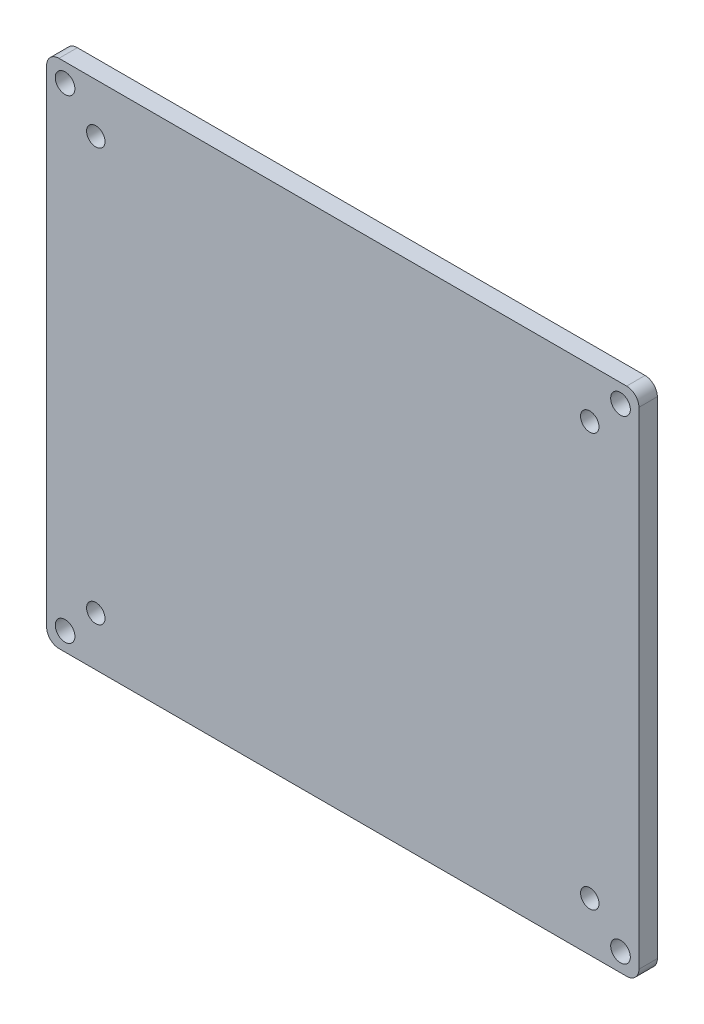
from build123d import *

# Parameters (mm, degrees)
SKETCH_1_W          = 96.4
SKETCH_1_H          = 83.2
SKETCH_1_R          = 1.6
EXTRUDE_1_DEPTH     = 3
FILLET_1_R          = 2
SKETCH_1_3_R        = 1.5
CUT_EXTRUDE_3_DEPTH = 3


with BuildPart() as part:
    # 草图1 → 凸台-拉伸1 (new body)
    with BuildSketch(Plane.XY):
        Rectangle(SKETCH_1_W, SKETCH_1_H)
        with Locations((-45.2, -38.6)):
            Circle(SKETCH_1_R, mode=Mode.SUBTRACT)
        with Locations((45.2, -38.6)):
            Circle(SKETCH_1_R, mode=Mode.SUBTRACT)
        with Locations((45.2, 38.6)):
            Circle(SKETCH_1_R, mode=Mode.SUBTRACT)
        with Locations((-45.2, 38.6)):
            Circle(SKETCH_1_R, mode=Mode.SUBTRACT)
    extrude(amount=EXTRUDE_1_DEPTH)

    # 圆角1
    fillet_1_edges = [part.edges().sort_by_distance(p)[0] for p in [
        (48.2, -41.6, 1.5),
        (-48.2, -41.6, 1.5),
        (-48.2, 41.6, 1.5),
        (48.2, 41.6, 1.5),
    ]]
    fillet(fillet_1_edges, radius=FILLET_1_R)

    # 草图1<3> → 切除-拉伸3 (cut)
    with BuildSketch(Plane.XY):
        with Locations((-40.2, 33.6)):
            Circle(SKETCH_1_3_R)
        with Locations((40.2, 33.6)):
            Circle(SKETCH_1_3_R)
        with Locations((-40.2, -33.6)):
            Circle(SKETCH_1_3_R)
        with Locations((40.2, -33.6)):
            Circle(SKETCH_1_3_R)
    extrude(amount=CUT_EXTRUDE_3_DEPTH, mode=Mode.SUBTRACT)


solid = part.part
